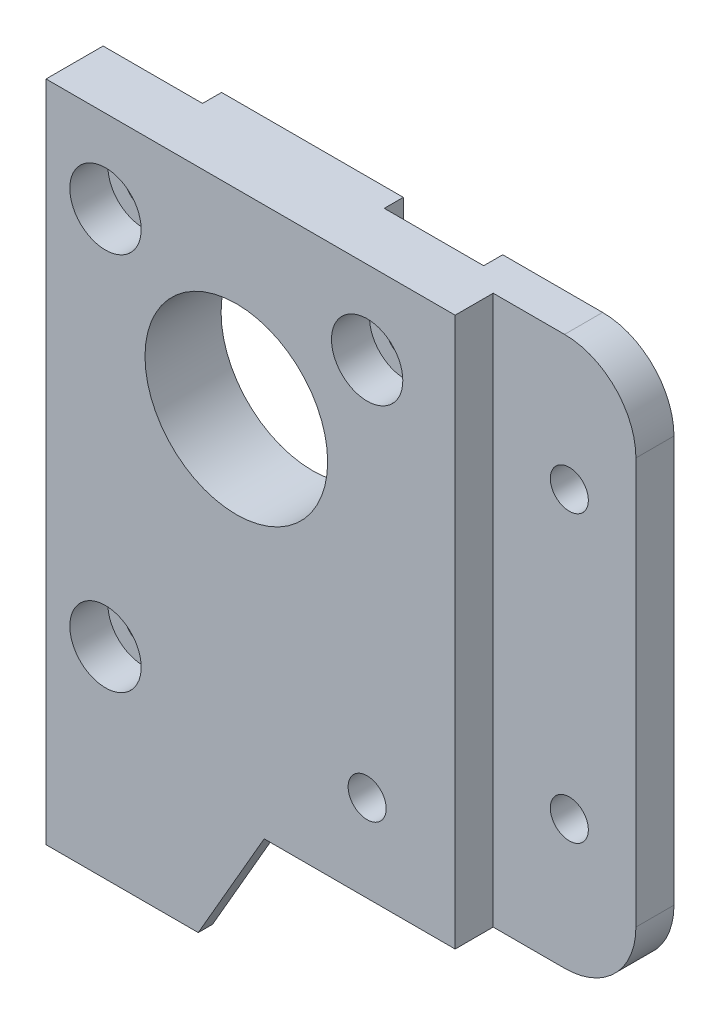
from build123d import *

# Parameters (mm, degrees)
SKETCH1_R           = 9.6
SKETCH1_R_2         = 4.2
BOSS_EXTRUDE1_DEPTH = 2
SKETCH4_W           = 58
SKETCH4_H           = 57.7
SKETCH4_R           = 2
SKETCH4_R_2         = 9.6
BOSS_EXTRUDE3_DEPTH = 2
SKETCH5_R           = 2
CUT_EXTRUDE1_DEPTH  = 4
SKETCH6_W           = 43
SKETCH6_H           = 57.7
SKETCH6_R           = 3.75
SKETCH6_R_2         = 9.6
SKETCH6_R_3         = 2
BOSS_EXTRUDE4_DEPTH = 4
CUT_EXTRUDE2_DEPTH  = 48.878204854
BOSS_EXTRUDE5_DEPTH = 6
BOSS_EXTRUDE6_DEPTH = 1.5


with BuildPart() as part:
    # Sketch1 → Boss-Extrude1 (new body)
    with BuildSketch(Plane.XY):
        with BuildLine():
            Line((38, 28.85), (20, 28.85))
            Line((20, 28.85), (20, 21.79369023))
            Line((20, 21.79369023), (17.201699017, 17.757141063))
            ThreePointArc((17.201699017, 17.757141063), (12.496432266, 16.141438171), (9.55, 20.15))
            Line((9.55, 20.15), (9.55, 28.85))
            Line((9.55, 28.85), (-9.55, 28.85))
            Line((-9.55, 28.85), (-9.55, 20.15))
            ThreePointArc((-9.55, 20.15), (-12.496432266, 16.141438171), (-17.201699017, 17.757141063))
            Line((-17.201699017, 17.757141063), (-20, 21.79369023))
            Line((-20, 21.79369023), (-20, -16.371914064))
            Line((-20, -16.371914064), (-16.312, -16.371914064))
            Line((-16.312, -16.371914064), (-12.349992933, -13.321914064))
            ThreePointArc((-12.349992933, -13.321914064), (-6.459906996, -14.088), (-7.225992933, -19.978085936))
            Line((-7.225992933, -19.978085936), (-11.188, -23.028085936))
            ThreePointArc((-11.188, -23.028085936), (-12.396848296, -23.676050863), (-13.75, -23.9))
            Line((-13.75, -23.9), (-13.75, -28.85))
            Line((-13.75, -28.85), (9.55, -28.85))
            Line((9.55, -28.85), (9.55, -19.7))
            ThreePointArc((9.55, -19.7), (12.496432266, -15.691438171), (17.201699017, -17.307141063))
            Line((17.201699017, -17.307141063), (20, -21.34369023))
            Line((20, -21.34369023), (20, -28.85))
            Line((20, -28.85), (38, -28.85))
            Line((38, -28.85), (38, 28.85))
        make_face()
        with Locations((0, 8.8)):
            Circle(SKETCH1_R, mode=Mode.SUBTRACT)
        with Locations((-5.725, -6.1)):
            Circle(SKETCH1_R_2, mode=Mode.SUBTRACT)
        with Locations((5.725, -6.1)):
            Circle(SKETCH1_R_2, mode=Mode.SUBTRACT)
    extrude(amount=BOSS_EXTRUDE1_DEPTH)

    # Sketch4 → Boss-Extrude3 (add)
    with BuildSketch(Plane.XY.offset(2)):
        with Locations((9, 0)):
            Rectangle(SKETCH4_W, SKETCH4_H)
        with Locations((13.75, -19.7)):
            Circle(SKETCH4_R, mode=Mode.SUBTRACT)
        with Locations((-13.75, 20.15)):
            Circle(SKETCH4_R, mode=Mode.SUBTRACT)
        with Locations((13.75, 20.15)):
            Circle(SKETCH4_R, mode=Mode.SUBTRACT)
        with Locations((-13.75, -19.7)):
            Circle(SKETCH4_R, mode=Mode.SUBTRACT)
        with Locations((0, 8.8)):
            Circle(SKETCH4_R_2, mode=Mode.SUBTRACT)
    extrude(amount=BOSS_EXTRUDE3_DEPTH)

    # Sketch5 → Cut-Extrude1 (cut)
    with BuildSketch(Plane.XY.offset(4)):
        with Locations((31, 15)):
            Circle(SKETCH5_R)
        with Locations((31, -15)):
            Circle(SKETCH5_R)
    extrude(amount=-CUT_EXTRUDE1_DEPTH, mode=Mode.SUBTRACT)

    # Sketch6 → Boss-Extrude4 (add)
    with BuildSketch(Plane.XY.offset(4)):
        with Locations((1.5, 0)):
            Rectangle(SKETCH6_W, SKETCH6_H)
        with Locations((-13.75, -19.7)):
            Circle(SKETCH6_R, mode=Mode.SUBTRACT)
        with Locations((0, 8.8)):
            Circle(SKETCH6_R_2, mode=Mode.SUBTRACT)
        with Locations((-13.75, 20.15)):
            Circle(SKETCH6_R, mode=Mode.SUBTRACT)
        with Locations((13.75, 20.15)):
            Circle(SKETCH6_R, mode=Mode.SUBTRACT)
        with Locations((13.75, -19.7)):
            Circle(SKETCH6_R_3, mode=Mode.SUBTRACT)
    extrude(amount=BOSS_EXTRUDE4_DEPTH)

    # Sketch7 → Cut-Extrude2 (cut, through all)
    with BuildSketch(Plane.XY.offset(4)):
        with BuildLine():
            Line((30.5, 28.85), (38, 28.85))
            Line((38, 28.85), (38, 21.35))
            ThreePointArc((38, 21.35), (35.803300859, 26.653300859), (30.5, 28.85))
        make_face()
        with BuildLine():
            Line((38, -28.85), (38, -21.35))
            ThreePointArc((38, -21.35), (35.803300859, -26.653300859), (30.5, -28.85))
            Line((30.5, -28.85), (38, -28.85))
        make_face()
    extrude(amount=-CUT_EXTRUDE2_DEPTH, mode=Mode.SUBTRACT)

    # Sketch9 → Boss-Extrude5 (add)
    with BuildSketch(Plane.ZY.offset(20)):
        Polygon((8, -28.85), (8, -40.85), (0, -40.85), (0, -35.15), (2, -35.15), (2, -28.85), align=None)
    extrude(amount=-BOSS_EXTRUDE5_DEPTH)

    # Sketch10 → Boss-Extrude6 (add)
    with BuildSketch(Plane.XY.offset(8)):
        Polygon((-14, -40.85), (-4, -40.85), (2.92820323, -28.85), (-14, -28.85), align=None)
    extrude(amount=-BOSS_EXTRUDE6_DEPTH)


solid = part.part
